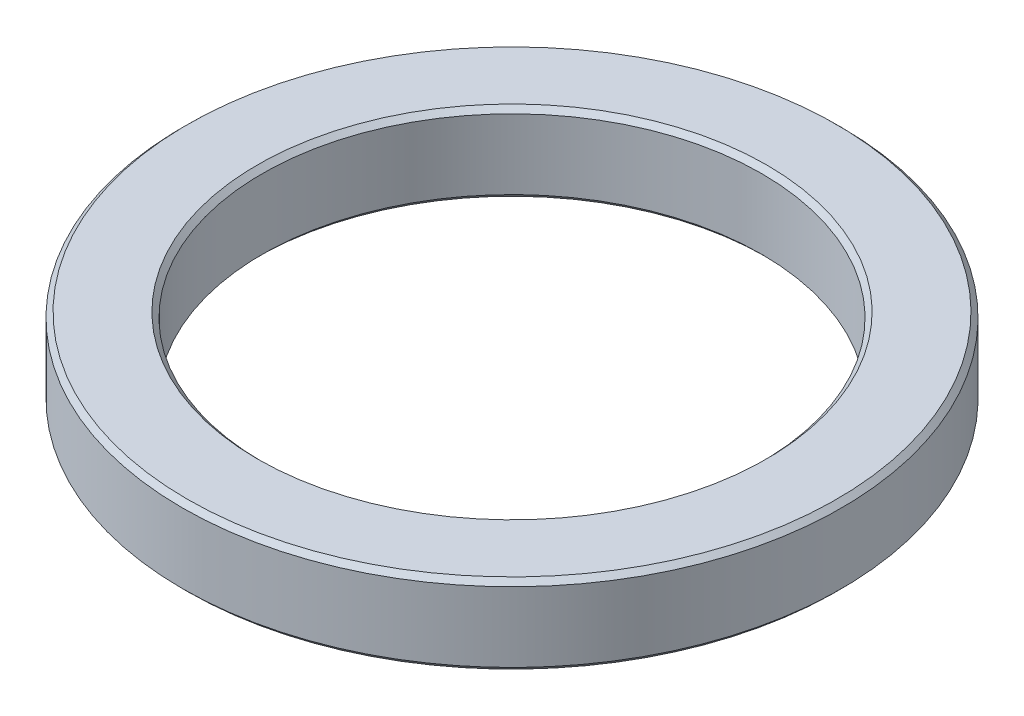
from build123d import *

# Parameters (mm, degrees)
SKETCH_2_R      = 33
SKETCH_2_R_2    = 25
EXTRUDE_1_DEPTH = 4
CHAMFER_1_SIZE  = 0.5


with BuildPart() as part:
    # 草图2 → 凸台-拉伸1 (new, symmetric)
    with BuildSketch(Plane(origin=(0, 0, 0), x_dir=(1, 0, 0), z_dir=(0, 1, 0))):
        with Locations(Location((0, 0, 0), (0, 0, 270))):
            Circle(SKETCH_2_R)
        with Locations(Location((0, 0, 0), (0, 0, 270))):
            Circle(SKETCH_2_R_2, mode=Mode.SUBTRACT)
    extrude(amount=EXTRUDE_1_DEPTH, both=True)

    # 倒角1
    chamfer_1_edges = [part.edges().sort_by_distance(p)[0] for p in [
        (0, -4, -33),
        (0, 4, -33),
        (0, -4, -25),
        (0, 4, -25),
    ]]
    chamfer(chamfer_1_edges, length=CHAMFER_1_SIZE)


solid = part.part
